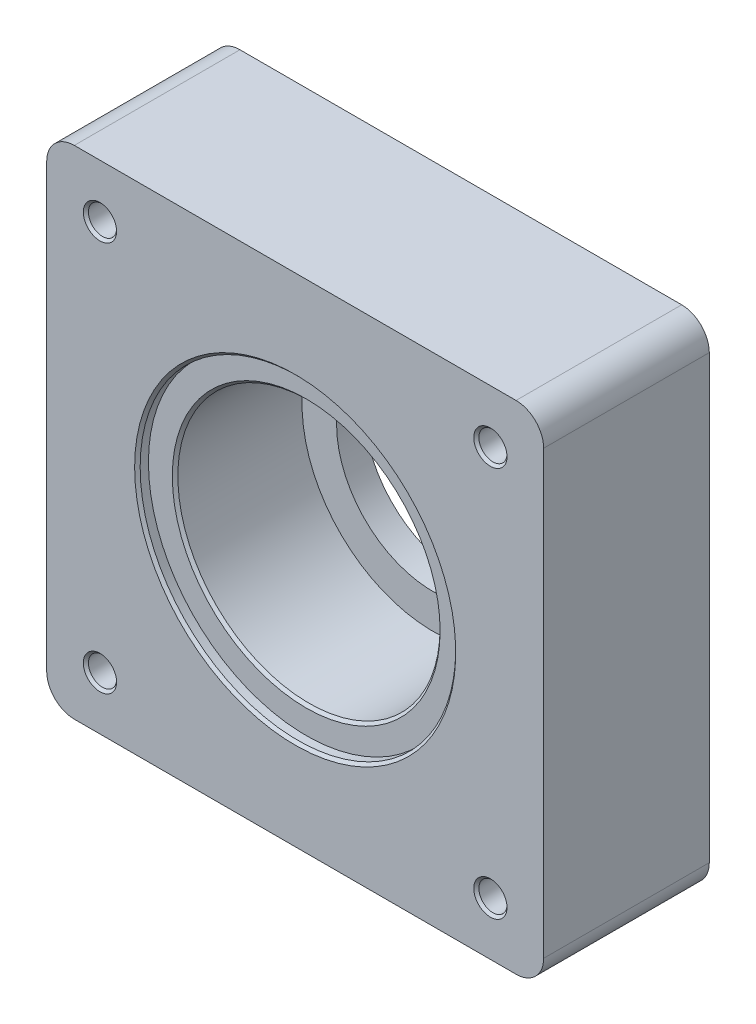
from build123d import *

# Parameters (mm, degrees)
SKETCH1_R                         = 35
BOSS_EXTRUDE1_DEPTH               = 60
M12X1_75_TAPPED_HOLE1_D           = 10.2
M12X1_75_TAPPED_HOLE1_DEPTH       = 35.25
M12X1_75_TAPPED_HOLE1_CSINK_D     = 12.05
M12X1_75_TAPPED_HOLE1_CSINK_ANGLE = 90
M12X1_75_TAPPED_HOLE1_TIP         = 3.064389157
SKETCH5_R                         = 57.15
CUT_EXTRUDE1_DEPTH                = 4
CIRPATTERN1_COUNT                 = 6
SKETCH9_R                         = 47.5
CUT_EXTRUDE2_DEPTH                = 50
CHAMFER1_SIZE                     = 1
M12_TAPPED_HOLE2_D                = 10.2
M12_TAPPED_HOLE2_DEPTH            = 35.25
M12_TAPPED_HOLE2_CSINK_D          = 12.05
M12_TAPPED_HOLE2_CSINK_ANGLE      = 90
M12_TAPPED_HOLE2_TIP              = 3.064389157


with BuildPart() as part:
    # Sketch1 → Boss-Extrude1 (new body)
    with BuildSketch(Plane.XY):
        with BuildLine():
            Line((-80, -90), (80, -90))
            ThreePointArc((80, -90), (87.071067812, -87.071067812), (90, -80))
            Line((90, -80), (90, 80))
            ThreePointArc((90, 80), (87.071067812, 87.071067812), (80, 90))
            Line((80, 90), (-80, 90))
            ThreePointArc((-80, 90), (-87.071067812, 87.071067812), (-90, 80))
            Line((-90, 80), (-90, -80))
            ThreePointArc((-90, -80), (-87.071067812, -87.071067812), (-80, -90))
        make_face()
        Circle(SKETCH1_R, mode=Mode.SUBTRACT)
    extrude(amount=BOSS_EXTRUDE1_DEPTH)

    # M12x1.75 Tapped Hole1
    with Locations(Plane.XY.offset(60)):
        with Locations((-70.710678119, 70.710678119), (70.710678119, 70.710678119), (70.710678119, -70.710678119), (-70.710678119, -70.710678119)):
            CounterSinkHole(M12X1_75_TAPPED_HOLE1_D / 2, M12X1_75_TAPPED_HOLE1_CSINK_D / 2, depth=M12X1_75_TAPPED_HOLE1_DEPTH, counter_sink_angle=M12X1_75_TAPPED_HOLE1_CSINK_ANGLE)
            with Locations((0, 0, -(M12X1_75_TAPPED_HOLE1_DEPTH + M12X1_75_TAPPED_HOLE1_TIP / 2))):  # 118° drill point
                Cone(0, M12X1_75_TAPPED_HOLE1_D / 2, M12X1_75_TAPPED_HOLE1_TIP, mode=Mode.SUBTRACT)

    # Sketch5 → Cut-Extrude1 (cut)
    with BuildSketch(Plane.XY.offset(60)):
        Circle(SKETCH5_R)
    extrude(amount=-CUT_EXTRUDE1_DEPTH, mode=Mode.SUBTRACT)

    # Sketch8 → M12 Tapped Hole1 (revolve, cut)
    with BuildSketch(Plane(origin=(39, 67.549981495, 0), x_dir=(0, 1, 0), z_dir=(1, 0, 0))):
        Polygon((0, 0), (0, 38.314389157), (5.1, 35.25), (5.1, 0.925), (6.025, 0), align=None)
    m12_tapped_hole1 = revolve(axis=Axis((39, 67.549981495, -6.35), (0, 0, 1)), mode=Mode.SUBTRACT)

    # CirPattern1: M12 Tapped Hole1 ×6 about axis
    cirpattern1_axis = Axis((0, 0, 0), (0, 0, 1))
    for i in range(1, CIRPATTERN1_COUNT):
        add(m12_tapped_hole1.rotate(cirpattern1_axis, i * 360 / CIRPATTERN1_COUNT), mode=Mode.SUBTRACT)

    # Sketch9 → Cut-Extrude2 (cut)
    with BuildSketch(Plane.XY.offset(60)):
        Circle(SKETCH9_R)
    extrude(amount=-CUT_EXTRUDE2_DEPTH, mode=Mode.SUBTRACT)

    # Chamfer1
    chamfer1_edges = [part.edges().sort_by_distance(p)[0] for p in [
        (-57.15, 0, 60),
        (-47.5, 0, 56),
    ]]
    chamfer(chamfer1_edges, length=CHAMFER1_SIZE)

    # M12 Tapped Hole2
    with Locations(Plane(origin=(29.849307724, 72.062603536, 0), x_dir=(-1, 0, 0), z_dir=(0, 0, -1))):
        with Locations((0, 0), (59.698615448, 0), (101.91191126, -42.213295812), (101.91191126, -101.91191126), (59.698615448, -144.125207072), (0, -144.125207072), (-42.213295812, -101.91191126), (-42.213295812, -42.213295812)):
            CounterSinkHole(M12_TAPPED_HOLE2_D / 2, M12_TAPPED_HOLE2_CSINK_D / 2, depth=M12_TAPPED_HOLE2_DEPTH, counter_sink_angle=M12_TAPPED_HOLE2_CSINK_ANGLE)
            with Locations((0, 0, -(M12_TAPPED_HOLE2_DEPTH + M12_TAPPED_HOLE2_TIP / 2))):  # 118° drill point
                Cone(0, M12_TAPPED_HOLE2_D / 2, M12_TAPPED_HOLE2_TIP, mode=Mode.SUBTRACT)


solid = part.part
